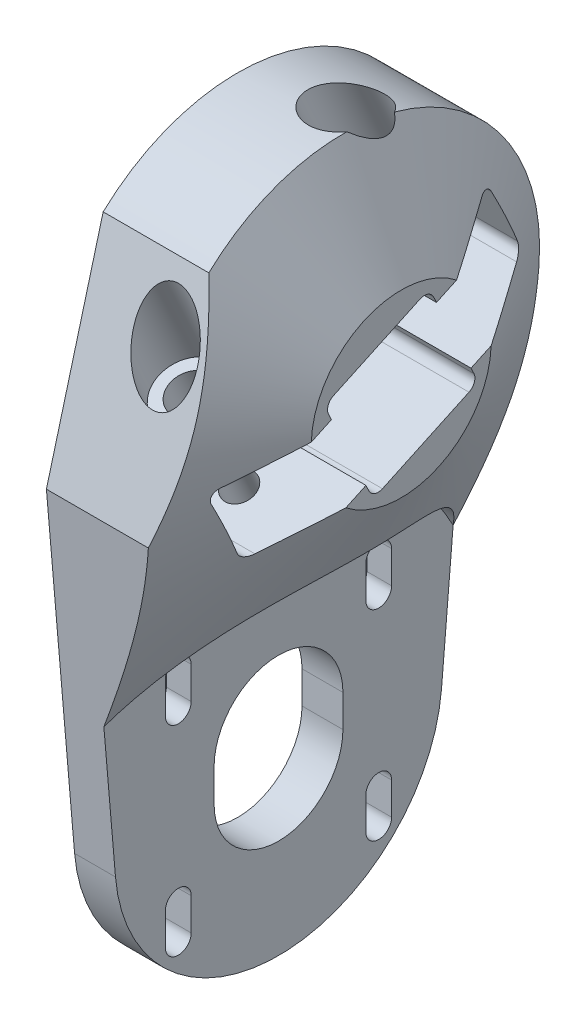
from build123d import *

# Parameters (mm, degrees)
BOSS_EXTRUDE1_DEPTH = 6.35
CUT_EXTRUDE18_DEPTH = 10
SKETCH20_R          = 57.15
BOSS_EXTRUDE5_DEPTH = 19.05
CUT_EXTRUDE14_DEPTH = 106.568863781
SKETCH22_R          = 3.175
CUT_EXTRUDE15_DEPTH = 112.672649781
SKETCH24_R          = 5
CUT_EXTRUDE16_DEPTH = 117.574618566
SKETCH25_R          = 2.38125
CUT_EXTRUDE17_DEPTH = 10
CHAMFER2_SIZE       = 2.5
FILLET1_R           = 1.5875
SKETCH28_R          = 30.48
CUT_EXTRUDE19_DEPTH = 105.22344993
CUT_EXTRUDE20_DEPTH = 100.947550226
CUT_EXTRUDE21_DEPTH = 94.849309593


with BuildPart() as part:
    # Sketch1 → Boss-Extrude1 (new body)
    with BuildSketch(Plane(origin=(0, 0, 0), x_dir=(0, 0, -1), z_dir=(1, 0, 0))):
        with BuildLine():
            Line((-30.369265969, -2.595782062), (-25.307721641, -61.813151718))
            ThreePointArc((-25.307721641, -61.813151718), (0, -85.05), (25.307721641, -61.813151718))
            Line((25.307721641, -61.813151718), (30.369265969, -2.595782062))
            ThreePointArc((30.369265969, -2.595782062), (0, 30.48), (-30.369265969, -2.595782062))
        make_face()
        Polygon((4.353205728, 11.960334439), (-11.960334439, 4.353205728), (-4.353205728, -11.960334439), (11.960334439, -4.353205728), align=None, mode=Mode.SUBTRACT)
    extrude(amount=BOSS_EXTRUDE1_DEPTH)

    # Sketch19 → Cut-Extrude18 (cut)
    with BuildSketch(Plane(origin=(6.35, 0, 0), x_dir=(0, 0, -1), z_dir=(1, 0, 0))):
        with BuildLine():
            Line((13.556349186, -39.093650814), (13.556349186, -44.093650814))
            ThreePointArc((13.556349186, -44.093650814), (15.556349186, -46.093650814), (17.556349186, -44.093650814))
            Line((17.556349186, -44.093650814), (17.556349186, -39.093650806))
            ThreePointArc((17.556349186, -39.093650806), (15.556349182, -37.093650814), (13.556349186, -39.093650814))
        make_face()
        with BuildLine():
            Line((-10, -54.65), (-10, -59.65))
            ThreePointArc((-10, -59.65), (0, -69.65), (10, -59.65))
            Line((10, -59.65), (10, -54.65))
            ThreePointArc((10, -54.65), (0, -44.65), (-10, -54.65))
        make_face()
        with BuildLine():
            Line((17.556349186, -75.206349194), (17.556349186, -70.206349186))
            ThreePointArc((17.556349186, -70.206349186), (15.556349186, -68.206349186), (13.556349186, -70.206349186))
            Line((13.556349186, -70.206349186), (13.556349186, -75.206349186))
            ThreePointArc((13.556349186, -75.206349186), (15.556349182, -77.206349186), (17.556349186, -75.206349194))
        make_face()
        with BuildLine():
            Line((-17.556349186, -39.093650806), (-17.556349186, -44.093650814))
            ThreePointArc((-17.556349186, -44.093650814), (-15.556349186, -46.093650814), (-13.556349186, -44.093650814))
            Line((-13.556349186, -44.093650814), (-13.556349186, -39.093650814))
            ThreePointArc((-13.556349186, -39.093650814), (-15.556349182, -37.093650814), (-17.556349186, -39.093650806))
        make_face()
        with BuildLine():
            Line((-13.556349186, -75.206349186), (-13.556349186, -70.206349186))
            ThreePointArc((-13.556349186, -70.206349186), (-15.556349186, -68.206349186), (-17.556349186, -70.206349186))
            Line((-17.556349186, -70.206349186), (-17.556349186, -75.206349194))
            ThreePointArc((-17.556349186, -75.206349194), (-15.556349182, -77.206349186), (-13.556349186, -75.206349186))
        make_face()
    extrude(amount=-CUT_EXTRUDE18_DEPTH, mode=Mode.SUBTRACT)

    # Sketch20 → Boss-Extrude5 (add)
    with BuildSketch(Plane(origin=(6.35, 0, 0), x_dir=(0, 0, -1), z_dir=(1, 0, 0))):
        with Locations(Location((0, 0, 0), (0, 0, 242.654471511))):
            Circle(SKETCH20_R)
    extrude(amount=BOSS_EXTRUDE5_DEPTH)

    # Sketch21 → Cut-Extrude14 (cut, through all)
    with BuildSketch(Plane.ZY):
        Polygon((-19.067760927, 15.897892729), (-24.435012851, 4.387783834), (-10.840396045, -1.951490092), (-5.473144121, 9.558618803), align=None)
        Polygon((-11.960334439, -4.353205728), (-4.353205728, 11.960334439), (11.960334439, 4.353205728), (4.353205728, -11.960334439), align=None)
        Polygon((10.840396045, 1.951490092), (5.473144121, -9.558618803), (19.067760927, -15.897892729), (24.435012851, -4.387783834), align=None)
    extrude(amount=-CUT_EXTRUDE14_DEPTH, mode=Mode.SUBTRACT)

    # Sketch22 → Cut-Extrude15 (cut, through all)
    with BuildSketch(Plane(origin=(0, 5.755054448, 2.683625962), x_dir=(-1, 0, 0), z_dir=(0, -0.9063077870366495, -0.4226182617407005))):
        with Locations(Location((-12.5, -16.5, 0), (0, 0, 90))):
            Circle(SKETCH22_R)
    cut_extrude15 = extrude(amount=-CUT_EXTRUDE15_DEPTH, mode=Mode.SUBTRACT)

    # Sketch24 → Cut-Extrude16 (cut, through all)
    with BuildSketch(Plane(origin=(0, 10.359098006, 4.830526732), x_dir=(-1, 0, 0), z_dir=(0, -0.9063077870366495, -0.4226182617407005))):
        with Locations(Location((-12.5, -16.5, 0), (0, 0, 90))):
            Circle(SKETCH24_R)
    cut_extrude16 = extrude(amount=-CUT_EXTRUDE16_DEPTH, mode=Mode.SUBTRACT)

    # Sketch25 → Cut-Extrude17 (cut)
    with BuildSketch(Plane(origin=(0, -5.755054448, -2.683625962), x_dir=(1, 0, 0), z_dir=(0, 0.9063077870366495, 0.4226182617407006))):
        with Locations(Location((12.5, -16.5, 0), (0, 0, 270))):
            Circle(SKETCH25_R)
    cut_extrude17 = extrude(amount=-CUT_EXTRUDE17_DEPTH, mode=Mode.SUBTRACT)

    # Mirror1: Cut-Extrude15, Cut-Extrude16, Cut-Extrude17 across plane
    add(cut_extrude15.mirror(Plane(origin=(0, 0, 0), x_dir=(1, 0, 0), z_dir=(0, 0.42261826174070105, -0.9063077870366493))), mode=Mode.SUBTRACT)
    add(cut_extrude16.mirror(Plane(origin=(0, 0, 0), x_dir=(1, 0, 0), z_dir=(0, 0.42261826174070105, -0.9063077870366493))), mode=Mode.SUBTRACT)
    add(cut_extrude17.mirror(Plane(origin=(0, 0, 0), x_dir=(1, 0, 0), z_dir=(0, 0.42261826174070105, -0.9063077870366493))), mode=Mode.SUBTRACT)


with BuildPart() as body_2:
    # Mirror2: mirrored copy
    add(part.part.mirror(Plane(origin=(0, 0, 0), x_dir=(0, 0, 1), z_dir=(1, 0, 0))))


with BuildPart() as part_1:
    add(part.part)

    # Chamfer2
    chamfer2_edges = [part_1.edges().sort_by_distance(p)[0] for p in [
        (0, -41.593650814, 13.556349186),
        (0, -37.093650814, 15.556349182),
        (0, -41.59365081, 17.556349186),
        (0, -46.093650814, 15.556349186),
        (0, -41.59365081, -17.556349186),
        (0, -37.093650814, -15.556349182),
        (0, -41.593650814, -13.556349186),
        (0, -46.093650814, -15.556349186),
    ]]
    chamfer(chamfer2_edges, length=CHAMFER2_SIZE)

    # Fillet1
    fillet1_edges = [part_1.edges().sort_by_distance(p)[0] for p in [
        (12.7, 4.387783834, -24.435012851),
        (12.7, 15.897892729, -19.067760927),
        (12.7, -4.387783834, 24.435012851),
        (12.7, -15.897892729, 19.067760927),
        (12.7, 11.960334439, -4.353205728),
        (12.7, 4.353205728, 11.960334439),
        (12.7, -11.960334439, 4.353205728),
        (12.7, -4.353205728, -11.960334439),
    ]]
    fillet(fillet1_edges, radius=FILLET1_R)

    # Sketch28 → Cut-Extrude19 (cut, through all)
    with BuildSketch(Plane(origin=(6.35, 0, 0), x_dir=(0, 0, -1), z_dir=(1, 0, 0))):
        with Locations((0, -54.65)):
            Circle(SKETCH28_R)
    extrude(amount=CUT_EXTRUDE19_DEPTH, mode=Mode.SUBTRACT)

    # Sketch31 → Cut-Revolve1 (revolve, cut)
    with BuildSketch(Plane(origin=(0, 0, 0), x_dir=(1, 0, 0), z_dir=(0, 1, 0)), mode=Mode.PRIVATE) as cut_revolve1_sk:
        Polygon((6.35, -59.952108656), (25.4, -59.952108656), (25.4, -13.97), (6.35, -48.91940088), align=None)
    revolve(cut_revolve1_sk.sketch.rotate(Axis((25.4, 0, 0), (-1, 0, 0)), 2.035690426), axis=Axis((25.4, 0, 0), (-1, 0, 0)), mode=Mode.SUBTRACT)

    # Sketch32 → Cut-Extrude20 (cut, through all)
    with BuildSketch(Plane.ZY.offset(-6.35)):
        with BuildLine():
            Line((30.369265969, -2.595782062), (27.110634253, -40.720035521))
            ThreePointArc((27.110634253, -40.720035521), (0, 48.91940088), (-27.110634253, -40.720035521))
            Line((-27.110634253, -40.720035521), (-30.369265969, -2.595782062))
            ThreePointArc((-30.369265969, -2.595782062), (0, 30.48), (30.369265969, -2.595782062))
        make_face()
    extrude(amount=-CUT_EXTRUDE20_DEPTH, mode=Mode.SUBTRACT)

    # Sketch33 → Cut-Extrude21 (cut, through all)
    with BuildSketch(Plane.ZY):
        with BuildLine():
            Line((29.679571242, -10.664842593), (30.369265969, -2.595782062))
            ThreePointArc((30.369265969, -2.595782062), (28.464776298, 10.898940787), (20.869520673, 22.214713747))
            Line((20.869520673, 22.214713747), (29.679571242, -10.664842593))
        make_face()
    extrude(amount=-CUT_EXTRUDE21_DEPTH, mode=Mode.SUBTRACT)


solid = part_1.part
